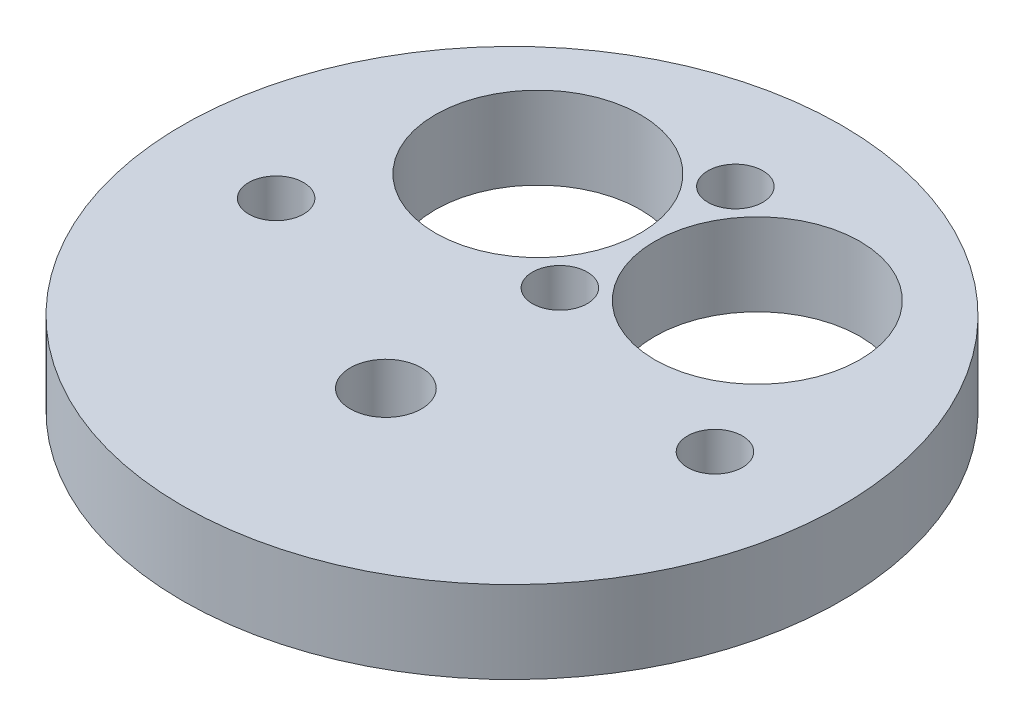
from build123d import *

# Parameters (mm, degrees)
SKETCH1_W               = 38.1508
SKETCH1_H               = 9.525
CUT_EXTRUDE1_DEPTH      = 55.787705795
CUT_EXTRUDE1_DEPTH_BACK = 55.787705795
SKETCH2_R               = 11.8745
SKETCH2_R_2             = 3.175
SKETCH2_R_3             = 4.1275
CUT_EXTRUDE2_DEPTH      = 55.787705795
CUT_EXTRUDE2_DEPTH_BACK = 55.787705795
SKETCH3_R               = 3.175


with BuildPart() as part:
    # Sketch1 → Revolve1 (revolve)
    with BuildSketch(Plane.XY):
        with Locations((19.0754, 4.7625)):
            Rectangle(SKETCH1_W, SKETCH1_H)
    revolve(axis=Axis((0, 0, 0), (0, 1, 0)))

    # Sketch2 → Cut-Extrude1 (cut, two sides: drawn at the far end of the back side and taken through both)
    with BuildSketch(Plane(origin=(0, 9.525, 0), x_dir=(1, 0, 0), z_dir=(0, 1, 0)).offset(-CUT_EXTRUDE1_DEPTH_BACK)):
        with Locations((-12.7, 15.699275429)):
            Circle(SKETCH2_R)
        with Locations((12.7, 15.699275429)):
            Circle(SKETCH2_R)
        with Locations((0, 25.859275429)):
            Circle(SKETCH2_R_2)
        with Locations((0, 5.539275429)):
            Circle(SKETCH2_R_2)
        with Locations((0, -14.605)):
            Circle(SKETCH2_R_3)
    extrude(amount=CUT_EXTRUDE1_DEPTH + CUT_EXTRUDE1_DEPTH_BACK, mode=Mode.SUBTRACT)

    # Sketch3 → Cut-Extrude2 (cut, two sides: drawn at the far end of the back side and taken through both)
    with BuildSketch(Plane(origin=(0, 9.525, 0), x_dir=(1, 0, 0), z_dir=(0, 1, 0)).offset(-CUT_EXTRUDE2_DEPTH_BACK)):
        with Locations((-25.4, -1.905)):
            Circle(SKETCH3_R)
        with Locations((25.4, -1.905)):
            Circle(SKETCH3_R)
    extrude(amount=CUT_EXTRUDE2_DEPTH + CUT_EXTRUDE2_DEPTH_BACK, mode=Mode.SUBTRACT)


solid = part.part
